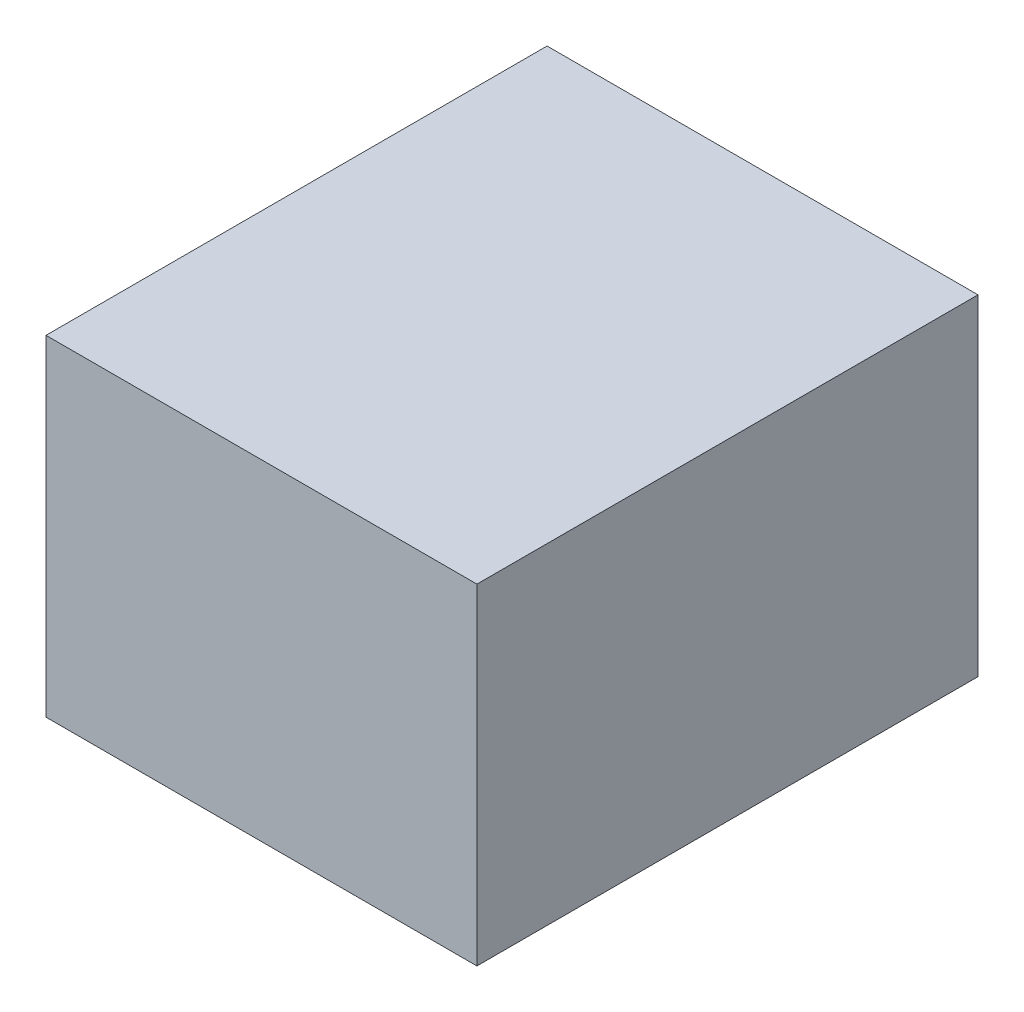
from build123d import *

# Parameters (mm, degrees)
SKETCH1_W           = 43
SKETCH1_H           = 50
BOSS_EXTRUDE1_DEPTH = 33


with BuildPart() as part:
    # Sketch1 → Boss-Extrude1 (new body)
    with BuildSketch(Plane(origin=(0, 0, 0), x_dir=(1, 0, 0), z_dir=(0, 1, 0))):
        Rectangle(SKETCH1_W, SKETCH1_H)
    extrude(amount=BOSS_EXTRUDE1_DEPTH)


solid = part.part
